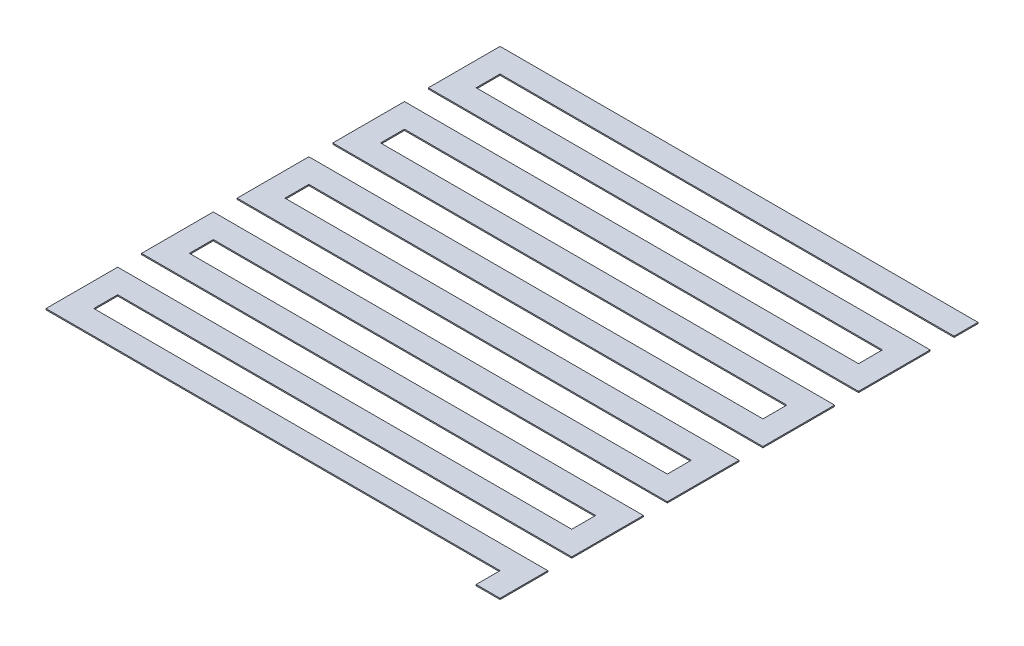
from build123d import *

# Parameters (mm, degrees)
BASE_D_W            = 20
BASE_D_H            = 20
BOSS_EXTRUDE1_DEPTH = 0.05
CUTR_W              = 19
CUTR_H              = 1
CUTRIGHT_DEPTH      = 15.142224012
CUTL_W              = 19
CUTL_H              = 1
CUTLEFT_DEPTH       = 15.142224012
PATT_RIGHT_COUNT    = 5
PATT_RIGHT_PITCH    = 4
PATT_LEFT_COUNT     = 5
PATT_LEFT_PITCH     = 4


with BuildPart() as part:
    # Base D → Boss-Extrude1 (new body)
    with BuildSketch(Plane(origin=(0, 0, 0), x_dir=(1, 0, 0), z_dir=(0, 1, 0))):
        Rectangle(BASE_D_W, BASE_D_H)
    extrude(amount=BOSS_EXTRUDE1_DEPTH)

    # cutR → CutRight (cut, through all)
    with BuildSketch(Plane(origin=(0, 0, 0), x_dir=(1, 0, 0), z_dir=(0, 1, 0))):
        with Locations((0.5, 8.5)):
            Rectangle(CUTR_W, CUTR_H)
    cutright = extrude(amount=CUTRIGHT_DEPTH, mode=Mode.SUBTRACT)

    # cutL → CutLeft (cut, through all)
    with BuildSketch(Plane(origin=(0, 0, 0), x_dir=(1, 0, 0), z_dir=(0, 1, 0))):
        with Locations((-0.5, 6.5)):
            Rectangle(CUTL_W, CUTL_H)
    cutleft = extrude(amount=CUTLEFT_DEPTH, mode=Mode.SUBTRACT)

    # Patt Right: CutRight ×5
    with Locations(*[(0, 0, i * PATT_RIGHT_PITCH) for i in range(1, PATT_RIGHT_COUNT)]):
        add(cutright, mode=Mode.SUBTRACT)

    # Patt Left: CutLeft ×5
    with Locations(*[(0, 0, i * PATT_LEFT_PITCH) for i in range(1, PATT_LEFT_COUNT)]):
        add(cutleft, mode=Mode.SUBTRACT)


solid = part.part
